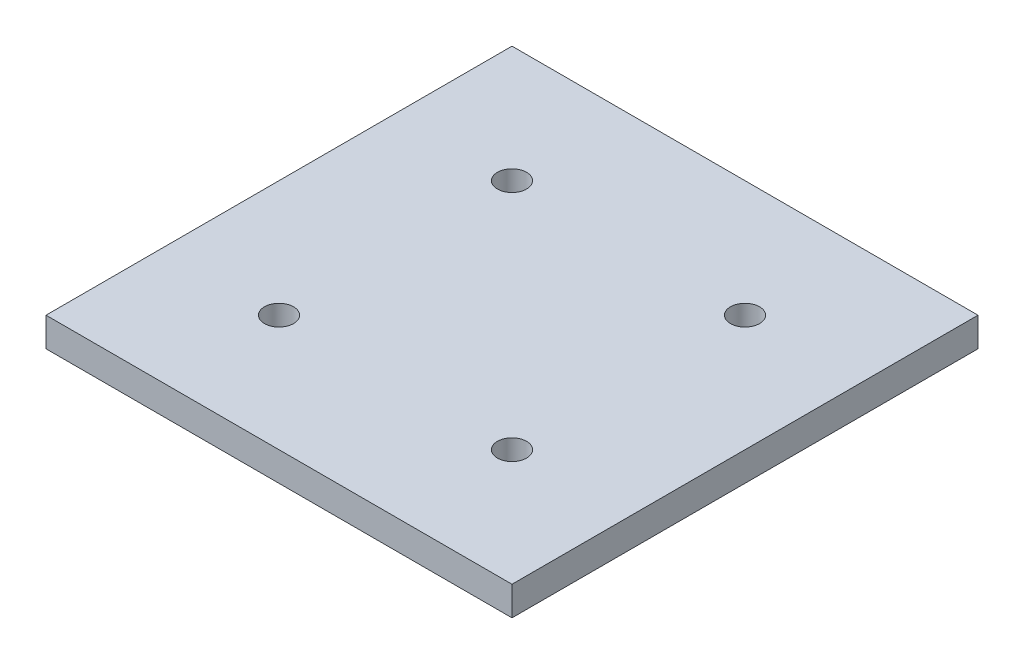
from build123d import *

# Parameters (mm, degrees)
SKETCH1_W           = 101.6
SKETCH1_H           = 101.6
SKETCH1_R           = 3.175
BOSS_EXTRUDE2_DEPTH = 6.35


with BuildPart() as part:
    # Sketch1 → Boss-Extrude2 (new body)
    with BuildSketch(Plane(origin=(0, 0, 0), x_dir=(1, 0, 0), z_dir=(0, 1, 0))):
        Rectangle(SKETCH1_W, SKETCH1_H)
        with Locations(Location((-25.4, 25.4, 0), (0, 0, 270))):
            Circle(SKETCH1_R, mode=Mode.SUBTRACT)
        with Locations(Location((25.4, 25.4, 0), (0, 0, 90))):
            Circle(SKETCH1_R, mode=Mode.SUBTRACT)
        with Locations(Location((25.4, -25.4, 0), (0, 0, 270))):
            Circle(SKETCH1_R, mode=Mode.SUBTRACT)
        with Locations(Location((-25.4, -25.4, 0), (0, 0, 90))):
            Circle(SKETCH1_R, mode=Mode.SUBTRACT)
    extrude(amount=BOSS_EXTRUDE2_DEPTH)


solid = part.part
